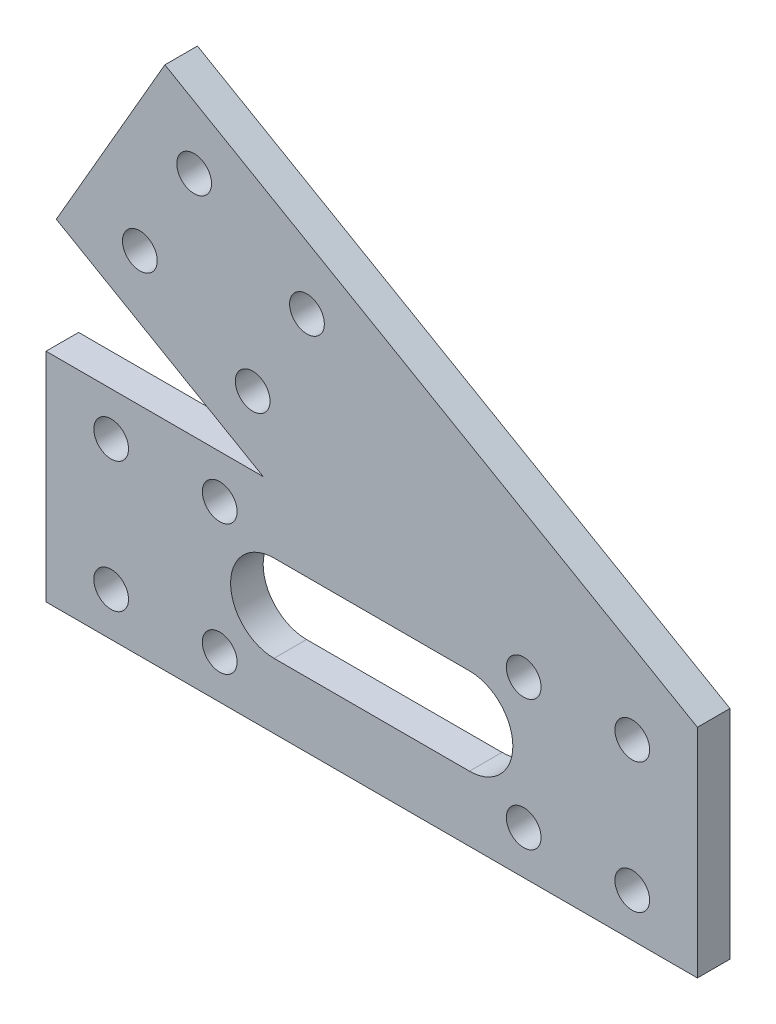
from build123d import *

# Parameters (mm, degrees)
EXTRUDE_1_DEPTH     = 3
SKETCH_2_R          = 1.6
CUT_EXTRUDE_1_DEPTH = 10


with BuildPart() as part:
    # 草图1 → 凸台-拉伸1 (new body)
    with BuildSketch(Plane.XY):
        Polygon((60, 0), (0, 0), (0, 20), (20, 20), (0.947441117, 31), (10.947441117, 48.320508076), (60, 20), align=None)
    extrude(amount=EXTRUDE_1_DEPTH)

    # 草图2 → 切除-拉伸1 (cut)
    with BuildSketch(Plane.XY.offset(3)):
        with Locations((13.643593539, 40.990381057)):
            Circle(SKETCH_2_R)
        with Locations((8.643593539, 32.330127019)):
            Circle(SKETCH_2_R)
        with Locations((24.035898385, 34.990381057)):
            Circle(SKETCH_2_R)
        with Locations((19.035898385, 26.330127019)):
            Circle(SKETCH_2_R)
        with Locations((6, 16)):
            Circle(SKETCH_2_R)
        with Locations((6, 4)):
            Circle(SKETCH_2_R)
        with Locations((54, 16)):
            Circle(SKETCH_2_R)
        with Locations((54, 4)):
            Circle(SKETCH_2_R)
        with Locations((16, 16)):
            Circle(SKETCH_2_R)
        with Locations((16, 4)):
            Circle(SKETCH_2_R)
        with Locations((44, 16)):
            Circle(SKETCH_2_R)
        with Locations((44, 4)):
            Circle(SKETCH_2_R)
        with BuildLine():
            Line((21, 14), (39, 14))
            ThreePointArc((39, 14), (43, 10), (39, 6))
            Line((39, 6), (21, 6))
            ThreePointArc((21, 6), (17, 10), (21, 14))
        make_face()
    extrude(amount=-CUT_EXTRUDE_1_DEPTH, mode=Mode.SUBTRACT)


solid = part.part
